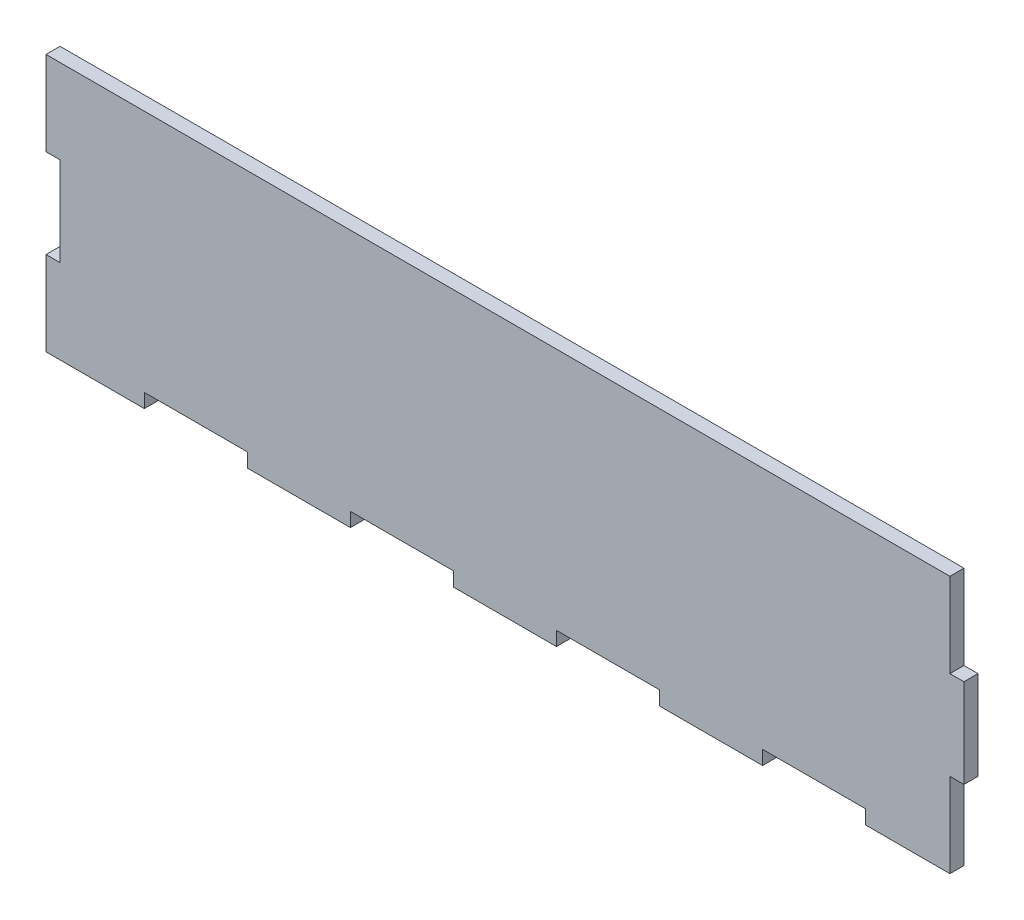
from build123d import *

# Parameters (mm, degrees)
BOSS_EXTRUDE1_DEPTH = 3


with BuildPart() as part:
    # Sketch1 → Boss-Extrude1 (new body)
    with BuildSketch(Plane.XY):
        Polygon((-95, -9.5), (-98, -9.5), (-98, -27.5), (-77, -27.5), (-77, -24.5), (-55, -24.5), (-55, -27.5), (-33, -27.5), (-33, -24.5), (-11, -24.5), (-11, -27.5), (11, -27.5), (11, -24.5), (33, -24.5), (33, -27.5), (55, -27.5), (55, -24.5), (77, -24.5), (77, -27.5), (95, -27.5), (95, -9.5), (98, -9.5), (98, 9.5), (95, 9.5), (95, 27.5), (-98, 27.5), (-98, 9.5), (-95, 9.5), align=None)
    extrude(amount=BOSS_EXTRUDE1_DEPTH)


solid = part.part
